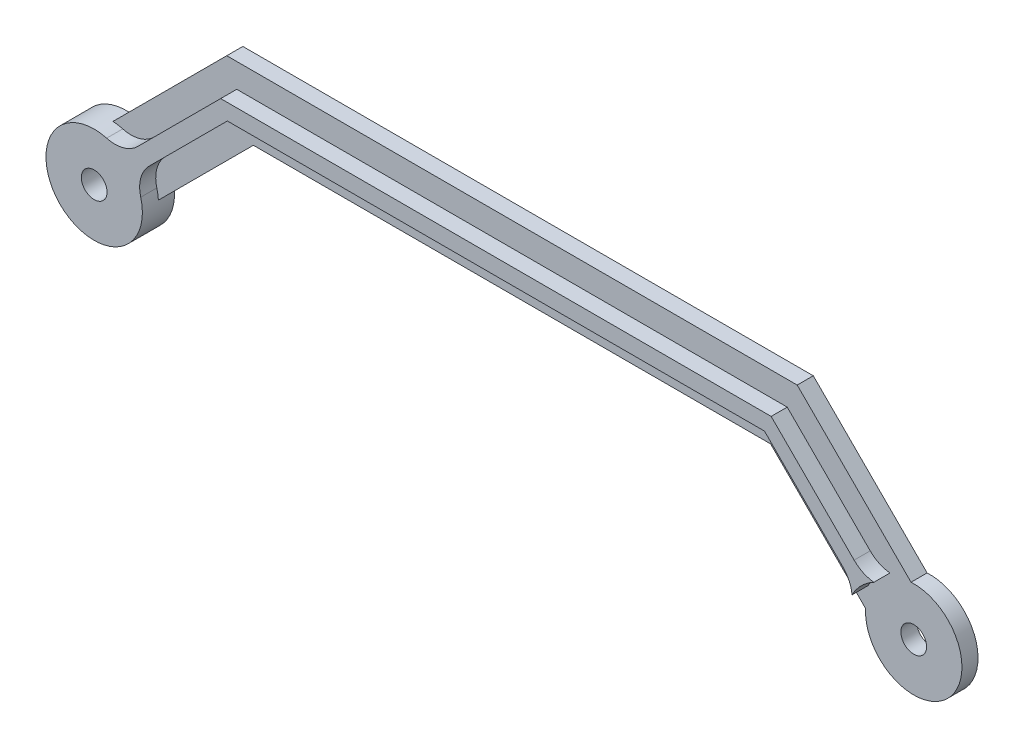
from build123d import *

# Parameters (mm, degrees)
SKETCH1_R             = 4
BOSS_EXTRUDE1_DEPTH   = 5
BOSS_EXTRUDE2_DEPTH   = 5
SKETCH7_R             = 15
SKETCH7_R_2           = 4
BOSS_EXTRUDE3_DEPTH   = 5
FILLET1_R             = 10
IZIM1_R               = 16
KES_EKSTR_ZYON1_DEPTH = 5
ECHELLE1_SCALE        = 0.6


with BuildPart() as part:
    # Sketch1 → Boss-Extrude1 (new body)
    with BuildSketch(Plane.XY):
        with BuildLine():
            Line((44.539250231, 30.397114607), (14.976761962, 0.834626339))
            ThreePointArc((14.976761962, 0.834626339), (-10.606601718, -10.606601718), (0.834626339, 14.976761962))
            Line((0.834626339, 14.976761962), (36.254978983, 50.397114607))
            Line((36.254978983, 50.397114607), (213.745021017, 50.397114607))
            Line((213.745021017, 50.397114607), (249.165373661, 14.976761962))
            ThreePointArc((249.165373661, 14.976761962), (260.606601718, -10.606601718), (235.023238038, 0.834626339))
            Line((235.023238038, 0.834626339), (205.460749769, 30.397114607))
            Line((205.460749769, 30.397114607), (44.539250231, 30.397114607))
        make_face()
        Circle(SKETCH1_R, mode=Mode.SUBTRACT)
        with Locations((250, 0)):
            Circle(SKETCH1_R, mode=Mode.SUBTRACT)
    extrude(amount=BOSS_EXTRUDE1_DEPTH)

    # Sketch6 → Boss-Extrude2 (add)
    with BuildSketch(Plane.XY.offset(5)):
        Polygon((243.862072803, 9.673461103), (210.638419299, 42.897114607), (39.361580701, 42.897114607), (6.137927197, 9.673461103), (9.673461103, 6.137927197), (41.432648513, 37.897114607), (208.567351487, 37.897114607), (240.326538897, 6.137927197), align=None)
    extrude(amount=BOSS_EXTRUDE2_DEPTH)

    # Sketch7 → Boss-Extrude3 (add)
    # profile 1 of 2: a face of its own
    with BuildSketch(Plane.XY.offset(5)):
        Circle(SKETCH7_R)
        Circle(SKETCH7_R_2, mode=Mode.SUBTRACT)
    # profile 2 of 2: a face of its own
    with BuildSketch(Plane.XY.offset(5)):
        with Locations((250, 0)):
            Circle(SKETCH7_R)
        with Locations((250, 0)):
            Circle(SKETCH7_R_2, mode=Mode.SUBTRACT)
    extrude(amount=BOSS_EXTRUDE3_DEPTH)

    # Fillet1
    fillet1_edges = [part.edges().sort_by_distance(p)[0] for p in [
        (237.773982715, 8.690483379, 7.5),
        (241.309516621, 12.226017285, 7.5),
        (8.690483379, 12.226017285, 7.5),
        (12.226017285, 8.690483379, 7.5),
    ]]
    fillet(fillet1_edges, radius=FILLET1_R)

    # Çizim1 → Kes-Ekstrüzyon1 (cut)
    with BuildSketch(Plane.XY.offset(10)):
        with Locations((250, 0)):
            Circle(IZIM1_R)
    extrude(amount=-KES_EKSTR_ZYON1_DEPTH, mode=Mode.SUBTRACT)


with BuildPart() as part_1:
    # Echelle1: scaled about (115.03902324, 27.032288503, 3.659762747)
    add(part.part.scale(ECHELLE1_SCALE).moved(Location((46.015609296, 10.812915401, 1.463905099))))


solid = part_1.part
